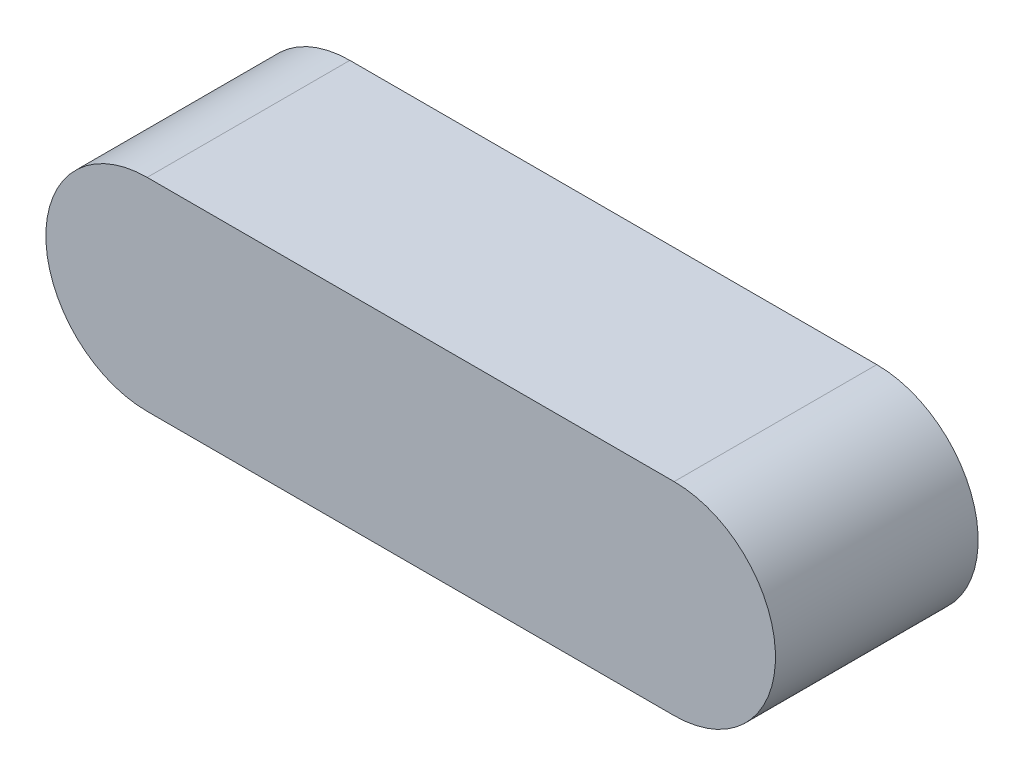
from build123d import *

# Parameters (mm, degrees)
EXTRUDE_1_DEPTH     = 25
SKETCH_2_R          = 1.5
CUT_EXTRUDE_1_DEPTH = 5


with BuildPart() as part:
    # 草图1 → 凸台-拉伸1 (new body)
    with BuildSketch(Plane.XY):
        with BuildLine():
            Line((0, 12.5), (65, 12.5))
            ThreePointArc((65, 12.5), (77.5, 0), (65, -12.5))
            Line((65, -12.5), (0, -12.5))
            ThreePointArc((0, -12.5), (-12.5, 0), (0, 12.5))
        make_face()
    extrude(amount=EXTRUDE_1_DEPTH)

    # 草图2 → 切除-拉伸1 (cut)
    with BuildSketch(Plane(origin=(0, 0, 0), x_dir=(-1, 0, 0), z_dir=(0, 0, -1))):
        with Locations((-9.75, 0)):
            Circle(SKETCH_2_R)
        with Locations(Location((-55.25, 0, 0), (0, 0, 180))):
            Circle(SKETCH_2_R)
    extrude(amount=-CUT_EXTRUDE_1_DEPTH, mode=Mode.SUBTRACT)


solid = part.part
